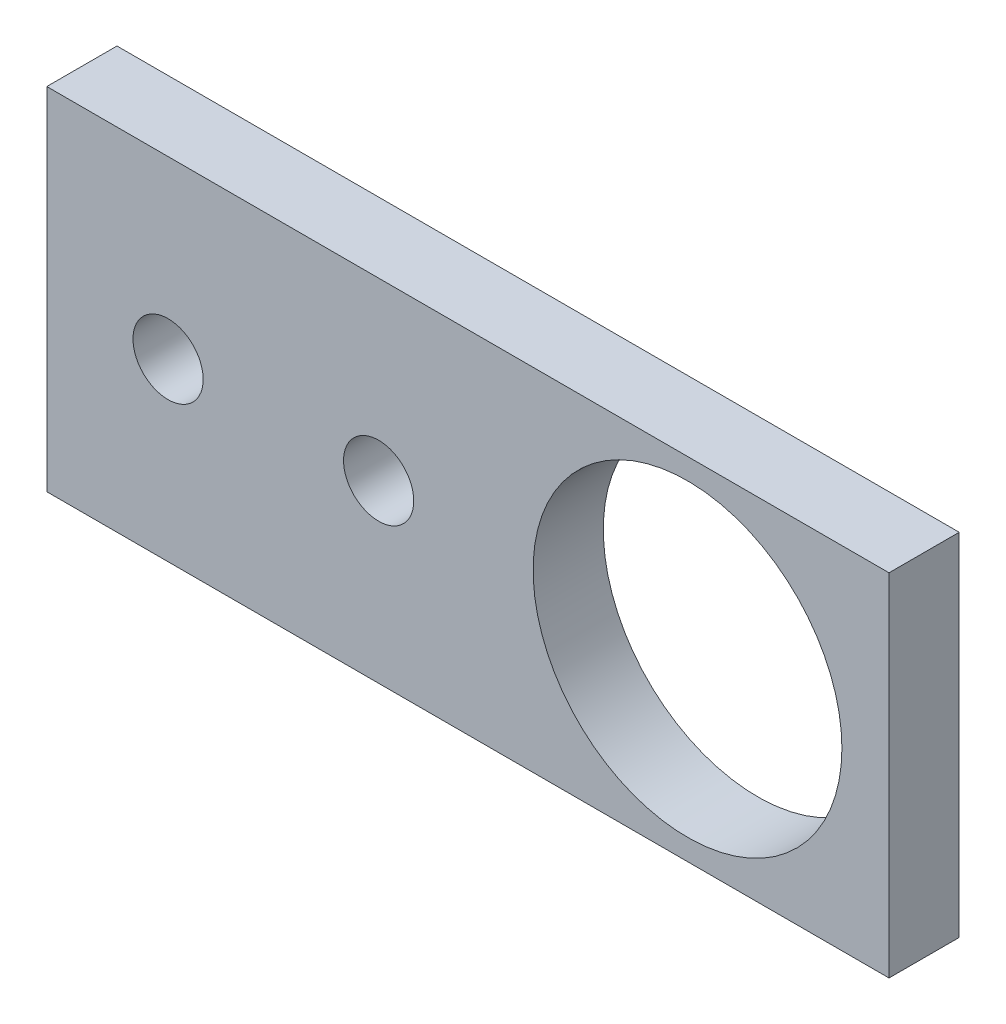
from build123d import *

# Parameters (mm, degrees)
SKETCH1_W           = 60
SKETCH1_H           = 25
SKETCH1_R           = 2.5
SKETCH1_R_2         = 11
BOSS_EXTRUDE2_DEPTH = 5


with BuildPart() as part:
    # Sketch1 → Boss-Extrude2 (new body)
    with BuildSketch(Plane.XY):
        Rectangle(SKETCH1_W, SKETCH1_H)
        with Locations((-21.359853693, 0)):
            Circle(SKETCH1_R, mode=Mode.SUBTRACT)
        with Locations((15.644174596, 0)):
            Circle(SKETCH1_R_2, mode=Mode.SUBTRACT)
        with Locations((-6.359853693, 0)):
            Circle(SKETCH1_R, mode=Mode.SUBTRACT)
    extrude(amount=BOSS_EXTRUDE2_DEPTH)


solid = part.part
